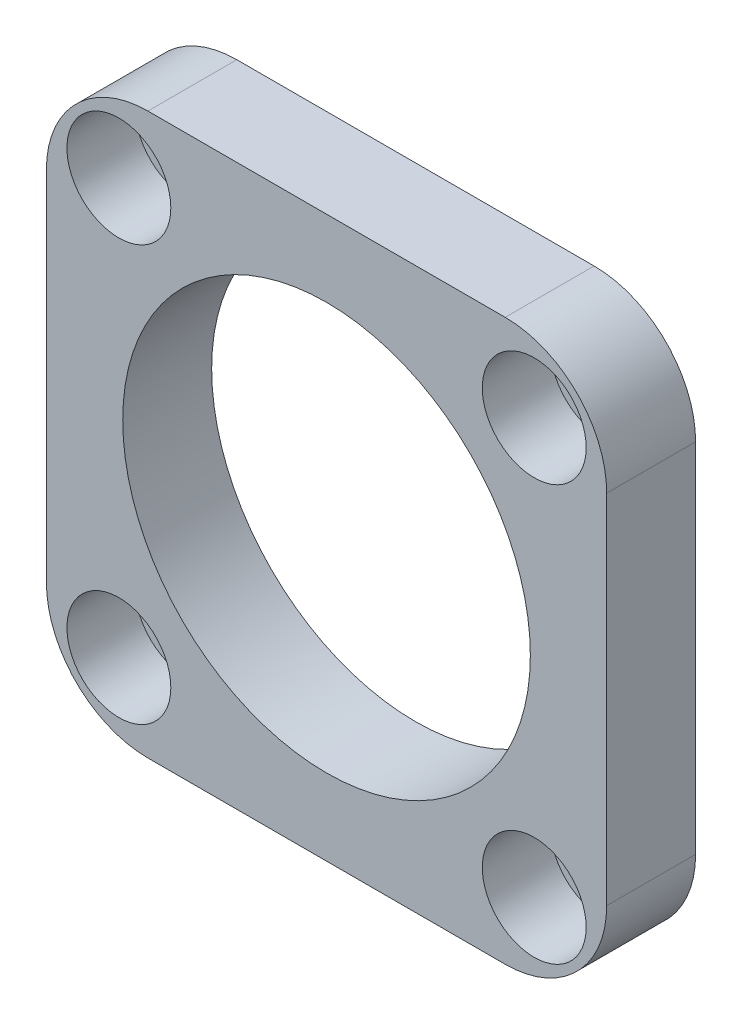
from build123d import *

# Parameters (mm, degrees)
SKETCH1_W                     = 35.052
SKETCH1_H                     = 35.052
BOSS_EXTRUDE1_DEPTH           = 5.5626
CBORE_FOR_M3_SHCS3_AT_2_COUNT = 2
CBORE_FOR_M3_SHCS3_AT_2_PITCH = 25.9842
CBORE_FOR_M3_SHCS3_AT_3_COUNT = 2
CBORE_FOR_M3_SHCS3_AT_3_PITCH = 36.747208047
CBORE_FOR_M3_SHCS3_AT_4_COUNT = 2
CBORE_FOR_M3_SHCS3_AT_4_PITCH = 25.9842
FILLET1_R                     = 6.35
CUT_EXTRUDE1_REACH            = 27.402
SKETCH4_R                     = 12.9032
CHAMFER1_SIZE                 = 0.762
CUT_EXTRUDE3_DEPTH            = 0.127
BOSS_EXTRUDE2_REACH           = 27.402
SKETCH10_R                    = 15
SKETCH10_R_2                  = 13.1
SKETCH13_W                    = 13.172247564
SKETCH13_H                    = 4
BOSS_EXTRUDE3_DEPTH           = 0.127
SKETCH14_R                    = 13.97225464
SKETCH14_R_2                  = 12.75
BOSS_EXTRUDE4_DEPTH           = 5.5626


with BuildPart() as part:
    # Sketch1 → Boss-Extrude1 (new body)
    with BuildSketch(Plane.XY):
        Rectangle(SKETCH1_W, SKETCH1_H)
    extrude(amount=BOSS_EXTRUDE1_DEPTH)

    # Sketch2 → CBORE for M3 SHCS3 (revolve, cut)
    with BuildSketch(Plane(origin=(-12.9921, 12.9921, 5.5626), x_dir=(0, -1, 0), z_dir=(1, 0, 0))):
        Polygon((0, 0), (0, 5.5626), (2, 5.5626), (1.7, 5.2626), (1.7, 4.27), (3.25, 4.27), (3.25, 0), align=None)
    cbore_for_m3_shcs3 = revolve(axis=Axis((-12.9921, 12.9921, 11.9126), (0, 0, -1)), mode=Mode.SUBTRACT)

    # CBORE for M3 SHCS3 at 2: CBORE for M3 SHCS3 ×2
    with Locations(*[(i * CBORE_FOR_M3_SHCS3_AT_2_PITCH, 0, 0) for i in range(1, CBORE_FOR_M3_SHCS3_AT_2_COUNT)]):
        add(cbore_for_m3_shcs3, mode=Mode.SUBTRACT)

    # CBORE for M3 SHCS3 at 3: CBORE for M3 SHCS3 ×2
    with Locations(*[Vector(0.7071067811865477, -0.7071067811865475, 0) * (i * CBORE_FOR_M3_SHCS3_AT_3_PITCH) for i in range(1, CBORE_FOR_M3_SHCS3_AT_3_COUNT)]):
        add(cbore_for_m3_shcs3, mode=Mode.SUBTRACT)

    # CBORE for M3 SHCS3 at 4: CBORE for M3 SHCS3 ×2
    with Locations(*[(0, -i * CBORE_FOR_M3_SHCS3_AT_4_PITCH, 0) for i in range(1, CBORE_FOR_M3_SHCS3_AT_4_COUNT)]):
        add(cbore_for_m3_shcs3, mode=Mode.SUBTRACT)

    # Fillet1
    fillet1_edges = [part.edges().sort_by_distance(p)[0] for p in [
        (-17.526, 17.526, 2.7813),
        (17.526, 17.526, 2.7813),
        (17.526, -17.526, 2.7813),
        (-17.526, -17.526, 2.7813),
    ]]
    fillet(fillet1_edges, radius=FILLET1_R)

    # Sketch4 → Cut-Extrude1 (cut, up to next)
    with BuildSketch(Plane.XY.offset(5.5626), mode=Mode.PRIVATE) as cut_extrude1_sk1:
        Circle(SKETCH4_R)
    cut_extrude1_tool1 = extrude(cut_extrude1_sk1.sketch, amount=-CUT_EXTRUDE1_REACH, mode=Mode.PRIVATE) & part.part
    add(cut_extrude1_tool1.solids().sort_by_distance((0, 0, 5.5626))[0], mode=Mode.SUBTRACT)

    # Chamfer1
    chamfer1_edges = [part.edges().sort_by_distance(p)[0] for p in [
        (-12.9032, 0, 5.5626),
        (-12.9032, 0, 0),
    ]]
    chamfer(chamfer1_edges, length=CHAMFER1_SIZE)

    # Sketch9 → Cut-Extrude3 (cut)
    # profile 1 of 6: a face of its own
    with BuildSketch(Plane.XY.offset(5.5626)):
        with BuildLine():
            Line((-6.112186903, -15.961583026), (-5.786207993, -15.961583026))
            add(Edge.make_bspline(
                [(-5.786207993, -15.961583026), (-5.782622414, -15.99085145), (-5.775734324, -16.047077667), (-5.756474536, -16.126769867), (-5.731685946, -16.198421333), (-5.700800047, -16.262983007), (-5.660170823, -16.319680798), (-5.611219596, -16.37082134), (-5.551770996, -16.415105953), (-5.484667078, -16.454516356), (-5.409932041, -16.485459756), (-5.330145724, -16.508398608), (-5.245688637, -16.521990061), (-5.187857622, -16.523742621), (-5.158328161, -16.524637507)],
                knots=[0, 0, 0, 0, 1.125557648, 2.162256852, 3.1243583, 4.018160113, 4.88511607, 5.777380551, 6.711250965, 7.707237736, 8.743031335, 9.791730543, 10.872421559, 12, 12, 12, 12], degree=3))
            add(Edge.make_bspline(
                [(-5.158328161, -16.524637507), (-5.132197131, -16.524153849), (-5.081246683, -16.523210811), (-5.007541166, -16.511882582), (-4.938184059, -16.495813793), (-4.874466172, -16.471507235), (-4.816622554, -16.441991452), (-4.766391851, -16.40629142), (-4.72350755, -16.36603159), (-4.689926033, -16.320151542), (-4.663545064, -16.272076924), (-4.644191896, -16.222661174), (-4.63266361, -16.172178574), (-4.631194607, -16.138211278), (-4.630464585, -16.121331214)],
                knots=[0, 0, 0, 0, 1.267006637, 2.470417599, 3.611360613, 4.716023143, 5.771382139, 6.754486395, 7.697536124, 8.612899418, 9.501261124, 10.352596716, 11.181322154, 12, 12, 12, 12], degree=3))
            add(Edge.make_bspline(
                [(-4.630464585, -16.121331214), (-4.631244992, -16.104622135), (-4.632770296, -16.071964264), (-4.642710283, -16.024418484), (-4.661602631, -15.980900285), (-4.686117624, -15.939633457), (-4.720222165, -15.901903883), (-4.763309404, -15.867139446), (-4.816328661, -15.835621671), (-4.855899559, -15.8183607), (-4.87680092, -15.80924345)],
                knots=[0, 0, 0, 0, 0.942140154, 1.841411588, 2.718743672, 3.605002079, 4.535543111, 5.568170452, 6.715506882, 8, 8, 8, 8], degree=3))
            add(Edge.make_bspline(
                [(-4.87680092, -15.80924345), (-4.8849444, -15.805901635), (-4.903341999, -15.798351868), (-4.93487462, -15.788357275), (-4.972292069, -15.775433247), (-5.01649327, -15.762123602), (-5.067241593, -15.748043859), (-5.124452548, -15.732107725), (-5.188094167, -15.715160518), (-5.256361463, -15.697122062), (-5.325290629, -15.678779719), (-5.391144395, -15.660420199), (-5.45173299, -15.641782934), (-5.507552716, -15.623837821), (-5.558315799, -15.605818672), (-5.604166314, -15.588218813), (-5.645161427, -15.571395321), (-5.670199682, -15.559025266), (-5.682024393, -15.553183312)],
                knots=[0, 0, 0, 0, 0.499201778, 1.127787504, 1.87543728, 2.745208432, 3.745951656, 4.863402235, 6.114490242, 7.482339553, 8.869366102, 10.161191451, 11.360587006, 12.46547846, 13.487450326, 14.41601931, 15.251940103, 16, 16, 16, 16], degree=3))
            add(Edge.make_bspline(
                [(-5.682024393, -15.553183312), (-5.709229755, -15.538486192), (-5.761743184, -15.510116925), (-5.832420443, -15.459392596), (-5.891973209, -15.403104565), (-5.94015024, -15.341334451), (-5.977904694, -15.275126936), (-6.003377459, -15.204369466), (-6.0208242, -15.130346422), (-6.022454643, -15.079443973), (-6.023283564, -15.053565068)],
                knots=[0, 0, 0, 0, 1.158441928, 2.236094408, 3.251151369, 4.220012324, 5.163146324, 6.095083285, 7.031536583, 8, 8, 8, 8], degree=3))
            add(Edge.make_bspline(
                [(-6.023283564, -15.053565068), (-6.022183421, -15.024908552), (-6.019995246, -14.967910949), (-6.000584929, -14.88427052), (-5.969625101, -14.803786179), (-5.934383416, -14.739888481), (-5.900014984, -14.691569327), (-5.871523293, -14.656770756), (-5.839564289, -14.624604156), (-5.805122199, -14.594620501), (-5.767581334, -14.567267784), (-5.727873088, -14.541421841), (-5.684560244, -14.519206633), (-5.623699257, -14.490931687), (-5.542281921, -14.462696509), (-5.439787678, -14.438093134), (-5.331915853, -14.423604717), (-5.258387882, -14.421610321), (-5.220838321, -14.420591815)],
                knots=[0, 0, 0, 0, 1.199927478, 2.386647047, 3.578628709, 4.806592355, 5.433127754, 6.062729195, 6.689531802, 7.331674828, 7.974827539, 8.635320743, 9.315455226, 10.01318112, 11.447700238, 12.918145351, 14.426146008, 16, 16, 16, 16], degree=3))
            add(Edge.make_bspline(
                [(-5.220838321, -14.420591815), (-5.179737832, -14.42153357), (-5.099707261, -14.423367348), (-4.98342058, -14.43862405), (-4.87495694, -14.464823821), (-4.789896032, -14.494151836), (-4.727011498, -14.523842472), (-4.682336574, -14.547009774), (-4.64086941, -14.573795396), (-4.602236719, -14.602781628), (-4.566079654, -14.633955234), (-4.533327533, -14.668057731), (-4.502558169, -14.703925603), (-4.466399878, -14.755420628), (-4.427413575, -14.823574004), (-4.393704609, -14.911869408), (-4.370546156, -15.005057959), (-4.366041305, -15.069481589), (-4.363754568, -15.102184082)],
                knots=[0, 0, 0, 0, 1.607600973, 3.130308851, 4.577334065, 5.967726088, 6.640410691, 7.296826776, 7.935019992, 8.569057421, 9.185393759, 9.8003086, 10.417295362, 11.032210203, 12.259799365, 13.477607022, 14.719591916, 16, 16, 16, 16], degree=3))
            Line((-4.363754568, -15.102184082), (-4.689733478, -15.102184082))
            add(Edge.make_bspline(
                [(-4.689733478, -15.102184082), (-4.6918047, -15.085632394), (-4.695857467, -15.053245647), (-4.705911845, -15.006360958), (-4.72000606, -14.962816568), (-4.736514706, -14.922206398), (-4.75652664, -14.884952836), (-4.779854764, -14.850698168), (-4.806783166, -14.819845972), (-4.83661895, -14.791581015), (-4.870270012, -14.766970127), (-4.907563443, -14.74560712), (-4.948562196, -14.727560272), (-4.993230151, -14.712779314), (-5.04157615, -14.701318738), (-5.093710159, -14.692888119), (-5.149612026, -14.688570422), (-5.18811077, -14.687732144), (-5.207873251, -14.687301832)],
                knots=[0, 0, 0, 0, 1.074487479, 2.102453544, 3.083708351, 4.020042547, 4.923259678, 5.803182661, 6.684453325, 7.556870173, 8.445961597, 9.363679789, 10.320905216, 11.327237703, 12.390948353, 13.519046902, 14.726457512, 16, 16, 16, 16], degree=3))
            add(Edge.make_bspline(
                [(-5.207873251, -14.687301832), (-5.228415428, -14.68745667), (-5.268180029, -14.687756396), (-5.325664271, -14.693220041), (-5.378944733, -14.700716355), (-5.427929899, -14.711774056), (-5.472459302, -14.726248623), (-5.513193821, -14.742963427), (-5.548993457, -14.764145449), (-5.580692763, -14.787739467), (-5.608037428, -14.813844944), (-5.63160448, -14.841353805), (-5.652447716, -14.86945782), (-5.668643371, -14.899693173), (-5.681829068, -14.930914805), (-5.690335291, -14.963709581), (-5.696357896, -14.997470882), (-5.696984707, -15.020506895), (-5.697304654, -15.03226531)],
                knots=[0, 0, 0, 0, 1.464176581, 2.834285765, 4.113735764, 5.29917439, 6.409476712, 7.449999357, 8.431575861, 9.367089851, 10.262376129, 11.120706676, 11.948504824, 12.751342953, 13.560717798, 14.359016663, 15.162382702, 16, 16, 16, 16], degree=3))
            add(Edge.make_bspline(
                [(-5.697304654, -15.03226531), (-5.696462248, -15.052152326), (-5.694827215, -15.090751192), (-5.678131139, -15.145588544), (-5.652452458, -15.195576344), (-5.627154866, -15.222774451), (-5.614420812, -15.236465167)],
                knots=[0, 0, 0, 0, 1.050964922, 2.039826012, 3.013306874, 4, 4, 4, 4], degree=3))
            add(Edge.make_bspline(
                [(-5.614420812, -15.236465167), (-5.6063934, -15.243307131), (-5.588641275, -15.258437714), (-5.55561071, -15.278461268), (-5.514657707, -15.298692517), (-5.465508627, -15.318803945), (-5.40824803, -15.339039702), (-5.342968281, -15.359874901), (-5.269420736, -15.38056815), (-5.189846754, -15.400509519), (-5.109458477, -15.420531053), (-5.033062589, -15.44047628), (-4.962918232, -15.459378867), (-4.899136695, -15.477815243), (-4.841651963, -15.495733279), (-4.790663816, -15.513508379), (-4.745759741, -15.529856963), (-4.718250689, -15.541359526), (-4.705476777, -15.546700777)],
                knots=[0, 0, 0, 0, 0.523891492, 1.158553688, 1.913783773, 2.794766643, 3.797521443, 4.933638669, 6.202080764, 7.596537849, 9.013317056, 10.322179469, 11.523240428, 12.626146501, 13.623953177, 14.517289671, 15.311498917, 16, 16, 16, 16], degree=3))
            add(Edge.make_bspline(
                [(-4.705476777, -15.546700777), (-4.688857269, -15.554363437), (-4.65623596, -15.569403956), (-4.610023508, -15.595083378), (-4.566902276, -15.621750076), (-4.527220656, -15.650122007), (-4.491106957, -15.68025885), (-4.458157386, -15.711815304), (-4.428172939, -15.744614016), (-4.402363485, -15.779704736), (-4.379189244, -15.815668939), (-4.35891024, -15.853009271), (-4.342581975, -15.891945323), (-4.328261069, -15.932007757), (-4.317960229, -15.973642185), (-4.309882294, -16.01642807), (-4.305170569, -16.060566519), (-4.304715946, -16.090451045), (-4.304485675, -16.105587914)],
                knots=[0, 0, 0, 0, 1.198900896, 2.353241543, 3.461831299, 4.520043694, 5.547003373, 6.541368882, 7.508191797, 8.454912692, 9.392021408, 10.310662301, 11.235020644, 12.156274873, 13.095836685, 14.042125239, 15.00831306, 16, 16, 16, 16], degree=3))
            add(Edge.make_bspline(
                [(-4.304485675, -16.105587914), (-4.305691996, -16.135796991), (-4.308086945, -16.195772049), (-4.328708315, -16.284178059), (-4.361103397, -16.369842989), (-4.399094656, -16.437822829), (-4.435007878, -16.489749548), (-4.465176678, -16.527072101), (-4.498632143, -16.561582488), (-4.534550634, -16.594361855), (-4.573211023, -16.624741395), (-4.614939241, -16.652731454), (-4.659294867, -16.678623404), (-4.722633585, -16.710174262), (-4.806757926, -16.743179456), (-4.913915448, -16.770665063), (-5.026846497, -16.788495656), (-5.104391927, -16.790383764), (-5.143973976, -16.791347524)],
                knots=[0, 0, 0, 0, 1.197055466, 2.376552968, 3.581957237, 4.820753935, 5.454298064, 6.085440993, 6.72202542, 7.359198513, 8.013298489, 8.67051481, 9.351020706, 10.049282741, 11.476266879, 12.925760103, 14.430794493, 16, 16, 16, 16], degree=3))
            add(Edge.make_bspline(
                [(-5.143973976, -16.791347524), (-5.169141064, -16.791139834), (-5.218439795, -16.790732998), (-5.290878774, -16.785806091), (-5.360298372, -16.778679077), (-5.426630463, -16.76806331), (-5.489667035, -16.754136), (-5.549634362, -16.737411993), (-5.606674584, -16.718150851), (-5.660588399, -16.695500082), (-5.71123507, -16.669182362), (-5.759525276, -16.640792202), (-5.804669681, -16.608610624), (-5.84676332, -16.573143314), (-5.886872755, -16.53541489), (-5.923335571, -16.493884555), (-5.95739141, -16.449766805), (-5.988262105, -16.402657858), (-6.015840371, -16.353174055), (-6.04064109, -16.302146423), (-6.061536042, -16.249204796), (-6.078375386, -16.19461674), (-6.092639162, -16.138747559), (-6.102530761, -16.081131123), (-6.109803398, -16.021948325), (-6.111387709, -15.981823645), (-6.112186903, -15.961583026)],
                knots=[0, 0, 0, 0, 1.259822038, 2.467811403, 3.633536148, 4.752793854, 5.829021491, 6.863980041, 7.868367876, 8.841470325, 9.788447787, 10.724101269, 11.643985084, 12.560193707, 13.478453146, 14.398077254, 15.323914234, 16.266973849, 17.21495974, 18.158525798, 19.105629373, 20.061269543, 21.017128399, 21.990322895, 22.986232211, 24, 24, 24, 24], degree=3))
        make_face()
    # profile 2 of 6: a face of its own
    with BuildSketch(Plane.XY.offset(5.5626)):
        with BuildLine():
            Line((-3.919237872, -16.761713078), (-3.919237872, -14.450226262))
            Line((-3.919237872, -14.450226262), (-3.428880393, -14.450226262))
            Line((-3.428880393, -14.450226262), (-2.912129734, -16.072249162))
            add(Edge.make_bspline(
                [(-2.912129734, -16.072249162), (-2.906442871, -16.090623854), (-2.895444809, -16.12615944), (-2.879135988, -16.177476097), (-2.864297695, -16.225163426), (-2.850933476, -16.269373219), (-2.838321489, -16.309885978), (-2.827401496, -16.347034138), (-2.816961628, -16.380404901), (-2.810843398, -16.401613112), (-2.807946134, -16.41165618)],
                knots=[0, 0, 0, 0, 1.300204174, 2.514519184, 3.639827924, 4.676153899, 5.636536826, 6.507959918, 7.293450077, 8, 8, 8, 8], degree=3))
            add(Edge.make_bspline(
                [(-2.807946134, -16.41165618), (-2.804719254, -16.400693293), (-2.797852247, -16.377363569), (-2.786719732, -16.340681576), (-2.774874419, -16.300088824), (-2.76069921, -16.256283035), (-2.745923232, -16.208577034), (-2.73041392, -16.157010439), (-2.712524231, -16.102098082), (-2.700635639, -16.064081412), (-2.694501769, -16.044466868)],
                knots=[0, 0, 0, 0, 0.713638162, 1.518667645, 2.393860736, 3.354087503, 4.393659122, 5.512594909, 6.716633584, 8, 8, 8, 8], degree=3))
            Line((-2.694501769, -16.044466868), (-2.182844531, -14.450226262))
            Line((-2.182844531, -14.450226262), (-1.696654395, -14.450226262))
            Line((-1.696654395, -14.450226262), (-1.696654395, -16.761713078))
            Line((-1.696654395, -16.761713078), (-2.022633305, -16.761713078))
            Line((-2.022633305, -16.761713078), (-2.022633305, -14.805839618))
            Line((-2.022633305, -14.805839618), (-2.63940022, -16.761713078))
            Line((-2.63940022, -16.761713078), (-2.980196353, -16.761713078))
            Line((-2.980196353, -16.761713078), (-3.593258962, -14.805839618))
            Line((-3.593258962, -14.805839618), (-3.593258962, -16.761713078))
            Line((-3.593258962, -16.761713078), (-3.919237872, -16.761713078))
        make_face()
    # profile 3 of 6: a face of its own
    with BuildSketch(Plane.XY.offset(5.5626)):
        with BuildLine():
            Line((-0.303835416, -16.761713078), (-0.600179879, -16.761713078))
            Line((-0.600179879, -16.761713078), (-0.600179879, -14.960494385))
            add(Edge.make_bspline(
                [(-0.600179879, -14.960494385), (-0.61724342, -14.97695007), (-0.652708119, -15.011151409), (-0.712657445, -15.059554844), (-0.779568556, -15.108613776), (-0.852572566, -15.155789425), (-0.926987804, -15.20020021), (-0.998900551, -15.240140884), (-1.067110194, -15.273940385), (-1.112040253, -15.292422086), (-1.133599914, -15.301290518)],
                knots=[0, 0, 0, 0, 0.893362401, 1.856755847, 2.901947673, 4.020460078, 5.132200827, 6.168787962, 7.121294059, 8, 8, 8, 8], degree=3))
            Line((-1.133599914, -15.301290518), (-1.133599914, -15.028097966))
            add(Edge.make_bspline(
                [(-1.133599914, -15.028097966), (-1.096568969, -15.009026955), (-1.023583168, -14.971439121), (-0.920470014, -14.906519766), (-0.824202793, -14.836144512), (-0.736375108, -14.76032894), (-0.657643185, -14.682831817), (-0.59129465, -14.604634175), (-0.535778418, -14.528602403), (-0.507924873, -14.475578674), (-0.494607164, -14.450226262)],
                knots=[0, 0, 0, 0, 1.141258006, 2.249351951, 3.335817539, 4.406819942, 5.426913362, 6.360259544, 7.215985427, 8, 8, 8, 8], degree=3))
            Line((-0.494607164, -14.450226262), (-0.303835416, -14.450226262))
            Line((-0.303835416, -14.450226262), (-0.303835416, -16.761713078))
        make_face()
    # profile 4 of 6: a face of its own
    with BuildSketch(Plane.XY.offset(5.5626)):
        Polygon((0.239308421, -16.761713078), (1.157050182, -14.450226262), (1.524702533, -14.450226262), (2.442444293, -16.761713078), (2.09655474, -16.761713078), (1.833549028, -16.050486365), (0.848203687, -16.050486365), (0.585197975, -16.761713078), align=None)
        with BuildLine():
            Line((0.94636779, -15.783776348), (1.735384925, -15.783776348))
            Line((1.735384925, -15.783776348), (1.510811386, -15.176270197))
            add(Edge.make_bspline(
                [(1.510811386, -15.176270197), (1.502202038, -15.152796988), (1.485369138, -15.106902431), (1.460266212, -15.040221513), (1.437332584, -14.976898577), (1.414844278, -14.917841583), (1.394543683, -14.862192668), (1.375832103, -14.810327716), (1.35732651, -14.762607212), (1.346221042, -14.73177485), (1.340876357, -14.716936279)],
                knots=[0, 0, 0, 0, 1.225184869, 2.395467751, 3.491410812, 4.525364584, 5.492066482, 6.394148129, 7.227157926, 8, 8, 8, 8], degree=3))
            add(Edge.make_bspline(
                [(1.340876357, -14.716936279), (1.332035217, -14.753526888), (1.314316481, -14.826858981), (1.277217762, -14.934300334), (1.234778117, -15.040759088), (1.200312067, -15.109360382), (1.182980323, -15.143857522)],
                knots=[0, 0, 0, 0, 0.9891762, 1.982431084, 2.985436691, 4, 4, 4, 4], degree=3))
            Line((1.182980323, -15.143857522), (0.94636779, -15.783776348))
        make_face(mode=Mode.SUBTRACT)
    # profile 5 of 6: a face of its own
    with BuildSketch(Plane.XY.offset(5.5626)):
        with BuildLine():
            Line((2.570705882, -16.139389704), (2.867050345, -16.109755258))
            add(Edge.make_bspline(
                [(2.867050345, -16.109755258), (2.869984621, -16.126452642), (2.875692243, -16.158931651), (2.886568747, -16.20594598), (2.900694231, -16.249623605), (2.916565767, -16.290342801), (2.935431765, -16.327673012), (2.95587323, -16.362203663), (2.97997976, -16.392709023), (3.00532454, -16.420784552), (3.033142373, -16.445524059), (3.063701679, -16.466380316), (3.096149835, -16.484576137), (3.130882047, -16.499474068), (3.167951545, -16.510378568), (3.206886534, -16.519002156), (3.248188372, -16.523347541), (3.276368335, -16.52420202), (3.290730321, -16.524637507)],
                knots=[0, 0, 0, 0, 1.237781394, 2.407677316, 3.51963579, 4.58689595, 5.594855907, 6.570874, 7.510833816, 8.428091223, 9.330271693, 10.221190844, 11.124215526, 12.043132878, 12.973586933, 13.941700858, 14.950982896, 16, 16, 16, 16], degree=3))
            add(Edge.make_bspline(
                [(3.290730321, -16.524637507), (3.30834926, -16.524211782), (3.342803862, -16.523379259), (3.392928783, -16.516338112), (3.44027583, -16.504728077), (3.484618454, -16.488480694), (3.526476489, -16.468275152), (3.564461318, -16.442112655), (3.600644083, -16.412703424), (3.632696417, -16.377641976), (3.661873045, -16.339471733), (3.687054669, -16.29780729), (3.708254039, -16.253233438), (3.726101591, -16.205758725), (3.739280706, -16.155111944), (3.748975009, -16.101562526), (3.755198365, -16.045076359), (3.755784427, -16.006359983), (3.756083736, -15.98658709)],
                knots=[0, 0, 0, 0, 1.052816602, 2.058828735, 3.018813999, 3.961574988, 4.877590722, 5.788574389, 6.712363302, 7.658909047, 8.620312049, 9.580784896, 10.562948504, 11.56722449, 12.607883026, 13.686460295, 14.818448981, 16, 16, 16, 16], degree=3))
            add(Edge.make_bspline(
                [(3.756083736, -15.98658709), (3.755743547, -15.967743781), (3.755081119, -15.931051487), (3.749502397, -15.877621407), (3.740090437, -15.827380962), (3.727912241, -15.779776415), (3.711126134, -15.735551646), (3.691216866, -15.694065438), (3.666827177, -15.656198252), (3.639692037, -15.62077104), (3.608700282, -15.589011971), (3.573433219, -15.562195461), (3.535274352, -15.538725598), (3.493455124, -15.519693004), (3.447950909, -15.505552502), (3.399213893, -15.494672658), (3.346738359, -15.488950305), (3.31065282, -15.487947117), (3.292119435, -15.487431884)],
                knots=[0, 0, 0, 0, 1.165854935, 2.270189951, 3.319242023, 4.32700288, 5.306253956, 6.24172124, 7.169108591, 8.088047231, 8.999810445, 9.905349262, 10.822648491, 11.767237767, 12.739852311, 13.766490849, 14.852878837, 16, 16, 16, 16], degree=3))
            add(Edge.make_bspline(
                [(3.292119435, -15.487431884), (3.26907407, -15.488106006), (3.224878275, -15.48939882), (3.161373463, -15.500274795), (3.103562734, -15.517843548), (3.052100617, -15.544027637), (3.00612176, -15.575308831), (2.964670974, -15.610704922), (2.927406457, -15.650191979), (2.906965352, -15.679921149), (2.896684792, -15.694873009)],
                knots=[0, 0, 0, 0, 1.182877094, 2.268490576, 3.298955169, 4.273890847, 5.221533034, 6.149304476, 7.069219215, 8, 8, 8, 8], degree=3))
            Line((2.896684792, -15.694873009), (2.600340328, -15.665238562))
            Line((2.600340328, -15.665238562), (2.837415899, -14.479860708))
            Line((2.837415899, -14.479860708), (3.933890414, -14.479860708))
            Line((3.933890414, -14.479860708), (3.933890414, -14.776205172))
            Line((3.933890414, -14.776205172), (3.07958489, -14.776205172))
            Line((3.07958489, -14.776205172), (2.961973181, -15.374913596))
            add(Edge.make_bspline(
                [(2.961973181, -15.374913596), (2.978324675, -15.362643206), (3.010436422, -15.3385461), (3.060524993, -15.306994117), (3.111329777, -15.280397899), (3.162555027, -15.258617833), (3.214607648, -15.2416512), (3.267173531, -15.229863567), (3.320431652, -15.221896791), (3.356144363, -15.221114625), (3.374077201, -15.220721867)],
                knots=[0, 0, 0, 0, 1.093835215, 2.148119334, 3.164235237, 4.159999629, 5.123971815, 6.089888814, 7.040853737, 8, 8, 8, 8], degree=3))
            add(Edge.make_bspline(
                [(3.374077201, -15.220721867), (3.397415574, -15.221333351), (3.443374489, -15.222537511), (3.511096543, -15.232431202), (3.575850218, -15.249226398), (3.638143438, -15.271847079), (3.697154793, -15.301834656), (3.753482026, -15.338143244), (3.806897724, -15.381072125), (3.857099913, -15.429811319), (3.902635295, -15.483916948), (3.943390948, -15.541624431), (3.97667794, -15.604088914), (4.004674584, -15.669679437), (4.025790253, -15.739472694), (4.041817782, -15.812478175), (4.05038717, -15.889608615), (4.051737208, -15.94211649), (4.0524282, -15.968991638)],
                knots=[0, 0, 0, 0, 0.991958705, 1.953407265, 2.902004973, 3.832128134, 4.765371166, 5.71007953, 6.676509202, 7.674246545, 8.68000108, 9.679398714, 10.671856529, 11.683459888, 12.706765812, 13.76733029, 14.85725088, 16, 16, 16, 16], degree=3))
            add(Edge.make_bspline(
                [(4.0524282, -15.968991638), (4.051903493, -15.994634947), (4.050867049, -16.0452878), (4.042373169, -16.119934142), (4.028381521, -16.191861768), (4.009650566, -16.261283678), (3.984342531, -16.32780561), (3.953646254, -16.391642433), (3.918236377, -16.453460264), (3.889839492, -16.49156739), (3.875547598, -16.51074636)],
                knots=[0, 0, 0, 0, 1.059692978, 2.093196008, 3.100373587, 4.086253034, 5.061402885, 6.037282833, 7.012182238, 8, 8, 8, 8], degree=3))
            add(Edge.make_bspline(
                [(3.875547598, -16.51074636), (3.857390147, -16.533134255), (3.821672491, -16.577173648), (3.75982776, -16.634334144), (3.693343797, -16.682912698), (3.621824948, -16.722379254), (3.545751343, -16.754093973), (3.464188437, -16.775198927), (3.378121779, -16.789371741), (3.319035348, -16.790679868), (3.288878168, -16.791347524)],
                knots=[0, 0, 0, 0, 1.023140956, 2.012628108, 2.982342558, 3.942221589, 4.908720554, 5.902469194, 6.929439212, 8, 8, 8, 8], degree=3))
            add(Edge.make_bspline(
                [(3.288878168, -16.791347524), (3.264003278, -16.790842941), (3.215343001, -16.789855875), (3.144095698, -16.781274793), (3.076331087, -16.767590992), (3.01202794, -16.747964186), (2.950992528, -16.72316388), (2.893934308, -16.691658987), (2.839863096, -16.655619351), (2.789968279, -16.613934599), (2.744507605, -16.567440075), (2.703773917, -16.517120897), (2.668318454, -16.462944254), (2.638158329, -16.405234327), (2.613021256, -16.344046462), (2.593790402, -16.278963027), (2.578557966, -16.210622592), (2.573350687, -16.163382965), (2.570705882, -16.139389704)],
                knots=[0, 0, 0, 0, 1.108768375, 2.168973506, 3.19473529, 4.187459816, 5.162590879, 6.12651078, 7.088512529, 8.056012598, 9.019588496, 9.983680353, 10.938070192, 11.90157236, 12.88306954, 13.882379887, 14.924449348, 16, 16, 16, 16], degree=3))
        make_face()
    # profile 6 of 6: a face of its own
    with BuildSketch(Plane.XY.offset(5.5626)):
        with BuildLine():
            Line((4.348772663, -16.139389704), (4.645117127, -16.109755258))
            add(Edge.make_bspline(
                [(4.645117127, -16.109755258), (4.649067754, -16.127561388), (4.656711923, -16.16201493), (4.671420239, -16.211373208), (4.68695545, -16.257188726), (4.706214361, -16.298436703), (4.725006872, -16.336804009), (4.747090918, -16.370705343), (4.77068815, -16.401025237), (4.796234802, -16.427651106), (4.824025252, -16.45057923), (4.853688993, -16.470642575), (4.885853386, -16.48739817), (4.920272171, -16.500664517), (4.956655461, -16.511403739), (4.99520098, -16.519289354), (5.03611255, -16.523986913), (5.06415411, -16.524417104), (5.078520905, -16.524637507)],
                knots=[0, 0, 0, 0, 1.321063709, 2.556160278, 3.730472002, 4.821700466, 5.852032229, 6.822994757, 7.746964065, 8.632786469, 9.490489437, 10.352773447, 11.223141997, 12.11199479, 13.021433979, 13.96892724, 14.959401504, 16, 16, 16, 16], degree=3))
            add(Edge.make_bspline(
                [(5.078520905, -16.524637507), (5.095372646, -16.524397242), (5.128284123, -16.523928004), (5.176241574, -16.516887642), (5.221881546, -16.507220555), (5.264552877, -16.492062009), (5.304849742, -16.473535464), (5.342542568, -16.450640584), (5.377889359, -16.423756265), (5.410192927, -16.392699638), (5.439081927, -16.358536359), (5.464811641, -16.322451217), (5.486086658, -16.284136308), (5.504018293, -16.24413131), (5.517254185, -16.20178976), (5.526943926, -16.157639637), (5.533276222, -16.111481274), (5.533855086, -16.079987674), (5.534150518, -16.063914474)],
                knots=[0, 0, 0, 0, 1.111377895, 2.170522867, 3.193923215, 4.186422864, 5.152846954, 6.117443035, 7.091571248, 8.078879332, 9.069127402, 10.041602243, 10.999610288, 11.957618333, 12.930786866, 13.922135183, 14.939532534, 16, 16, 16, 16], degree=3))
            add(Edge.make_bspline(
                [(5.534150518, -16.063914474), (5.533803299, -16.048618368), (5.533123993, -16.018692758), (5.527539546, -15.974768383), (5.517794811, -15.933072303), (5.504286277, -15.893363209), (5.487025145, -15.855699396), (5.466277771, -15.81976942), (5.440902033, -15.786360688), (5.412339402, -15.75511436), (5.381185904, -15.726327527), (5.347093186, -15.701840621), (5.311214834, -15.680707623), (5.273123259, -15.663643553), (5.23297662, -15.650099703), (5.190813188, -15.640365473), (5.146430251, -15.634778603), (5.116197146, -15.634099178), (5.10074674, -15.633751963)],
                knots=[0, 0, 0, 0, 1.072815875, 2.098878726, 3.09954706, 4.07199174, 5.036203424, 6.001873089, 6.97636515, 7.972747947, 8.969130744, 9.945905975, 10.911575641, 11.885646534, 12.868345115, 13.879560892, 14.916365174, 16, 16, 16, 16], degree=3))
            add(Edge.make_bspline(
                [(5.10074674, -15.633751963), (5.087143596, -15.634112353), (5.058274552, -15.634877185), (5.01270954, -15.641630361), (4.962238572, -15.651086391), (4.927361692, -15.660366082), (4.909048915, -15.665238562)],
                knots=[0, 0, 0, 0, 0.837610211, 1.777604146, 2.833088267, 4, 4, 4, 4], degree=3))
            Line((4.909048915, -15.665238562), (4.939609438, -15.398528545))
            add(Edge.make_bspline(
                [(4.939609438, -15.398528545), (4.947627804, -15.399404734), (4.961793498, -15.400952657), (4.976030627, -15.401522517), (4.982208954, -15.401769813)],
                knots=[0, 0, 0, 0, 1.132082448, 2, 2, 2, 2], degree=3))
            add(Edge.make_bspline(
                [(4.982208954, -15.401769813), (5.009462831, -15.40072927), (5.062926372, -15.398688053), (5.140865849, -15.381727246), (5.214729615, -15.355023004), (5.271794145, -15.323160968), (5.314111272, -15.293192993), (5.340795602, -15.266172612), (5.364852902, -15.23749853), (5.382801614, -15.204608319), (5.398308194, -15.169661676), (5.407910608, -15.131281959), (5.414913474, -15.090402079), (5.415375461, -15.062087564), (5.415612732, -15.047545571)],
                knots=[0, 0, 0, 0, 1.557468908, 3.055264441, 4.54122591, 6.035034992, 6.780215604, 7.498173296, 8.201377046, 8.913174237, 9.633083494, 10.382644491, 11.169345745, 12, 12, 12, 12], degree=3))
            add(Edge.make_bspline(
                [(5.415612732, -15.047545571), (5.415393749, -15.035799513), (5.414965478, -15.012827537), (5.410194353, -14.979148195), (5.402303497, -14.947235981), (5.391638221, -14.91675016), (5.377660317, -14.887850505), (5.360326619, -14.860572393), (5.340522281, -14.834362468), (5.317143961, -14.810575085), (5.292107808, -14.788242266), (5.264500857, -14.769433452), (5.235636993, -14.752724585), (5.204498252, -14.740098475), (5.171853377, -14.729717753), (5.137423315, -14.722443364), (5.1011955, -14.717558124), (5.076376842, -14.717146478), (5.063703682, -14.716936279)],
                knots=[0, 0, 0, 0, 1.041493611, 2.036867705, 3.009952345, 3.954088258, 4.897230656, 5.850851638, 6.817653571, 7.805463921, 8.805067469, 9.788883576, 10.763797054, 11.758134544, 12.762883247, 13.799594994, 14.876406454, 16, 16, 16, 16], degree=3))
            add(Edge.make_bspline(
                [(5.063703682, -14.716936279), (5.038902628, -14.717903313), (4.991008119, -14.719770799), (4.922436793, -14.737048917), (4.860298792, -14.765007161), (4.814294812, -14.797794376), (4.78162794, -14.829140808), (4.759314737, -14.855710525), (4.739356841, -14.88505124), (4.721697688, -14.917152495), (4.706575858, -14.952143391), (4.692943949, -14.989590442), (4.682391586, -15.030093176), (4.677341415, -15.058157577), (4.674751573, -15.072549635)],
                knots=[0, 0, 0, 0, 1.533565899, 2.961543033, 4.347411787, 5.731829577, 6.434842101, 7.147085226, 7.87612511, 8.629021686, 9.412189982, 10.234506416, 11.094615066, 12, 12, 12, 12], degree=3))
            Line((4.674751573, -15.072549635), (4.37840711, -15.042915189))
            add(Edge.make_bspline(
                [(4.37840711, -15.042915189), (4.383042822, -15.020001512), (4.392136136, -14.975054532), (4.410662178, -14.910138846), (4.433254457, -14.849201502), (4.460380284, -14.792521885), (4.490758149, -14.739421677), (4.525801221, -14.690530726), (4.564687914, -14.645558369), (4.6074873, -14.60464178), (4.653618353, -14.56809869), (4.702848724, -14.536575479), (4.754774398, -14.509855015), (4.809443989, -14.488313594), (4.866814213, -14.470797155), (4.927048285, -14.45919247), (4.989873565, -14.451342486), (5.03265502, -14.450602914), (5.054442917, -14.450226262)],
                knots=[0, 0, 0, 0, 1.136581168, 2.229493434, 3.279335563, 4.293305329, 5.282068175, 6.250623624, 7.213783178, 8.169396253, 9.125981663, 10.071280146, 11.007896369, 11.961295906, 12.925420184, 13.920544621, 14.940967302, 16, 16, 16, 16], degree=3))
            add(Edge.make_bspline(
                [(5.054442917, -14.450226262), (5.084602554, -14.451204264), (5.14390615, -14.453127334), (5.231009313, -14.468400586), (5.314323029, -14.493464297), (5.39317688, -14.52820707), (5.466214225, -14.570661822), (5.530846256, -14.621541257), (5.586208929, -14.679965172), (5.631226948, -14.745294823), (5.666874903, -14.814851379), (5.693253318, -14.887054101), (5.709014817, -14.961819872), (5.710974409, -15.012436281), (5.711957196, -15.037821768)],
                knots=[0, 0, 0, 0, 1.104647871, 2.172094857, 3.229560912, 4.285649672, 5.322588163, 6.317201348, 7.289435229, 8.260615662, 9.214246199, 10.146367077, 11.070353327, 12, 12, 12, 12], degree=3))
            add(Edge.make_bspline(
                [(5.711957196, -15.037821768), (5.710960846, -15.061818592), (5.7089936, -15.10919917), (5.693848133, -15.178477969), (5.668255306, -15.24411184), (5.633663413, -15.306331065), (5.588806216, -15.3637901), (5.533806923, -15.414991338), (5.469545379, -15.460424697), (5.421386787, -15.484072258), (5.396628165, -15.496229611)],
                knots=[0, 0, 0, 0, 0.975609618, 1.926294443, 2.868398979, 3.832526731, 4.812148358, 5.820404151, 6.879456693, 8, 8, 8, 8], degree=3))
            add(Edge.make_bspline(
                [(5.396628165, -15.496229611), (5.413227169, -15.500420531), (5.445739772, -15.50862932), (5.492435244, -15.525637699), (5.536334229, -15.545550232), (5.578020996, -15.56810352), (5.616285299, -15.594776438), (5.652446075, -15.62394025), (5.685136362, -15.656999506), (5.715303257, -15.692775915), (5.742751428, -15.73089507), (5.765849333, -15.772098476), (5.785782153, -15.815302968), (5.802778968, -15.860821905), (5.81499284, -15.909006273), (5.823726145, -15.959482788), (5.829489413, -16.012076077), (5.830156507, -16.048001545), (5.830494982, -16.066229665)],
                knots=[0, 0, 0, 0, 1.053251915, 2.063013066, 3.05373318, 4.018979697, 4.975584284, 5.920798056, 6.874756953, 7.832116109, 8.799604348, 9.761196922, 10.734637845, 11.72654167, 12.747371341, 13.789206138, 14.878271633, 16, 16, 16, 16], degree=3))
            add(Edge.make_bspline(
                [(5.830494982, -16.066229665), (5.82993096, -16.091115433), (5.828822478, -16.140023954), (5.818314029, -16.211871684), (5.801140866, -16.280711469), (5.77737551, -16.346777075), (5.747261045, -16.410338128), (5.709472357, -16.470497673), (5.665129419, -16.527744726), (5.61492547, -16.581531168), (5.559922238, -16.630962564), (5.500190833, -16.673765426), (5.436913035, -16.710114291), (5.369985872, -16.739756611), (5.299586763, -16.763045225), (5.225645678, -16.779739247), (5.147933807, -16.789550496), (5.094909831, -16.790740632), (5.067871026, -16.791347524)],
                knots=[0, 0, 0, 0, 1.016055063, 1.996874249, 2.958724482, 3.910019225, 4.860394196, 5.826121543, 6.806008102, 7.814207964, 8.82789325, 9.821757317, 10.810247154, 11.803791187, 12.806673825, 13.834534493, 14.895752369, 16, 16, 16, 16], degree=3))
            add(Edge.make_bspline(
                [(5.067871026, -16.791347524), (5.043605942, -16.790890469), (4.995836237, -16.789990681), (4.925911252, -16.780616432), (4.858919482, -16.767313295), (4.795390659, -16.746804911), (4.734586841, -16.721795268), (4.677537822, -16.689799202), (4.62321782, -16.653068959), (4.572646622, -16.610555145), (4.526105079, -16.563631008), (4.484584456, -16.512990595), (4.448930414, -16.458746343), (4.417494387, -16.40170985), (4.392085948, -16.340805949), (4.372301455, -16.276557541), (4.357215513, -16.209203069), (4.351617567, -16.162914028), (4.348772663, -16.139389704)],
                knots=[0, 0, 0, 0, 1.08471039, 2.135426191, 3.150939737, 4.135689946, 5.116584603, 6.086901885, 7.055842759, 8.045878862, 9.036901429, 10.008421467, 10.96965771, 11.936653536, 12.917548193, 13.915472582, 14.940632654, 16, 16, 16, 16], degree=3))
        make_face()
    extrude(amount=-CUT_EXTRUDE3_DEPTH, mode=Mode.SUBTRACT)

    # Boss-Extrude2: up to this face of the body (flat: up to its plane)
    boss_extrude2_end = Plane(part.part.faces().sort_by_distance((0, 17.030289859, 5.5626))[0])
    # Sketch10 → Boss-Extrude2 (add, up to the picked face)
    with BuildSketch(Plane(origin=(0, 0, 0), x_dir=(-1, 0, 0), z_dir=(0, 0, -1)), mode=Mode.PRIVATE) as boss_extrude2_sk1:
        Circle(SKETCH10_R)
        with Locations(Location((0, 0, 0), (0, 0, 180))):
            Circle(SKETCH10_R_2, mode=Mode.SUBTRACT)
    boss_extrude2_tool1 = split(extrude(boss_extrude2_sk1.sketch, amount=-BOSS_EXTRUDE2_REACH, mode=Mode.PRIVATE), bisect_by=boss_extrude2_end, keep=Keep.BOTH, mode=Mode.PRIVATE)
    add(boss_extrude2_tool1.solids().sort_by(Axis((14.575736, 0, 0), (0, 0, 1)))[0])

    # Sketch13 → Boss-Extrude3 (add)
    with BuildSketch(Plane.XY.offset(5.5626)):
        with Locations((-0.302464428, -15.526)):
            Rectangle(SKETCH13_W, SKETCH13_H)
    extrude(amount=-BOSS_EXTRUDE3_DEPTH)

    # Sketch14 → Boss-Extrude4 (add)
    with BuildSketch(Plane.XY.offset(5.5626)):
        Circle(SKETCH14_R)
        Circle(SKETCH14_R_2, mode=Mode.SUBTRACT)
    extrude(amount=-BOSS_EXTRUDE4_DEPTH)


solid = part.part
